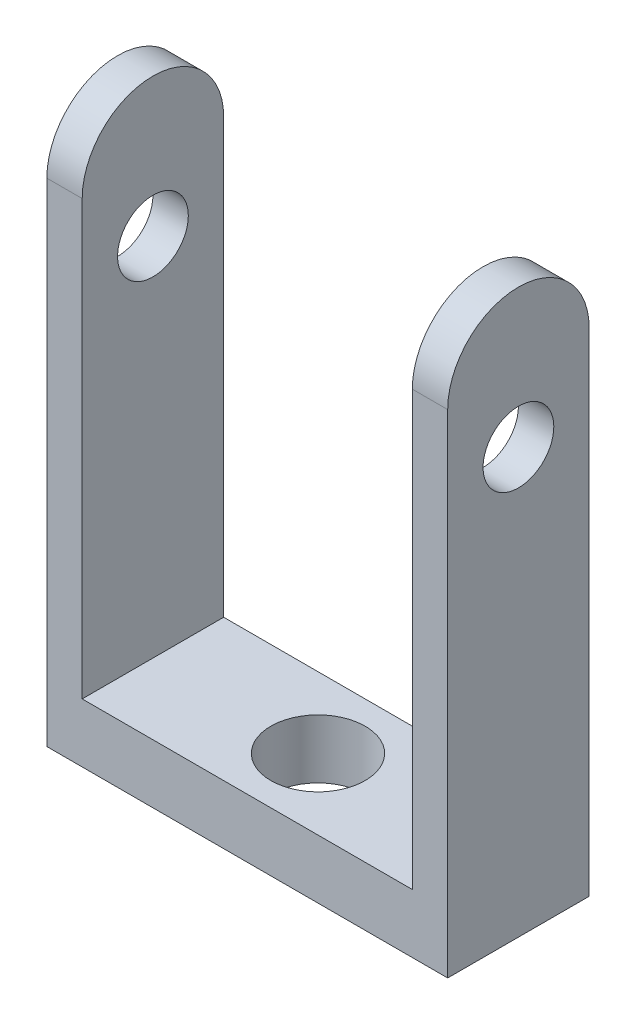
from build123d import *

# Parameters (mm, degrees)
SKETCH1_W           = 34
SKETCH1_H           = 12
BOSS_EXTRUDE1_DEPTH = 5
SKETCH5_R           = 3
BOSS_EXTRUDE3_DEPTH = 3
SKETCH6_R           = 1.5
CUT_EXTRUDE1_DEPTH  = 3
SKETCH8_R           = 4
CUT_EXTRUDE4_DEPTH  = 47.397777415


with BuildPart() as part:
    # Sketch1 → Boss-Extrude1 (new body)
    with BuildSketch(Plane(origin=(0, 0, 0), x_dir=(1, 0, 0), z_dir=(0, 1, 0))):
        Rectangle(SKETCH1_W, SKETCH1_H)
    extrude(amount=BOSS_EXTRUDE1_DEPTH)

    # Sketch5 → Boss-Extrude3 (add)
    with BuildSketch(Plane(origin=(17, 0, 0), x_dir=(0, 0, -1), z_dir=(1, 0, 0))):
        with BuildLine():
            Line((-6, 5), (6, 5))
            Line((6, 5), (6, 36))
            Line((6, 36), (6, 41.752236772))
            ThreePointArc((6, 41.752236772), (0, 47.752236772), (-6, 41.752236772))
            Line((-6, 41.752236772), (-6, 36))
            Line((-6, 36), (-6, 5))
        make_face()
        with Locations((0, 36)):
            Circle(SKETCH5_R, mode=Mode.SUBTRACT)
    boss_extrude3 = extrude(amount=-BOSS_EXTRUDE3_DEPTH)

    # Sketch6 → Cut-Extrude1 (cut)
    with BuildSketch(Plane(origin=(0, 5, 0), x_dir=(1, 0, 0), z_dir=(0, 1, 0))):
        with Locations(Location((0, 0, 0), (0, 0, 270))):
            Circle(SKETCH6_R)
    extrude(amount=-CUT_EXTRUDE1_DEPTH, mode=Mode.SUBTRACT)

    # Sketch8 → Cut-Extrude4 (cut, through all)
    with BuildSketch(Plane(origin=(0, 5, 0), x_dir=(1, 0, 0), z_dir=(0, 1, 0))):
        with Locations(Location((0, 0, 0), (0, 0, 270))):
            Circle(SKETCH8_R)
    extrude(amount=-CUT_EXTRUDE4_DEPTH, mode=Mode.SUBTRACT)

    # Mirror1: Boss-Extrude3 across plane
    add(boss_extrude3.mirror(Plane(origin=(0, 0, 0), x_dir=(0, 0, 1), z_dir=(1, 0, 0))))


solid = part.part
